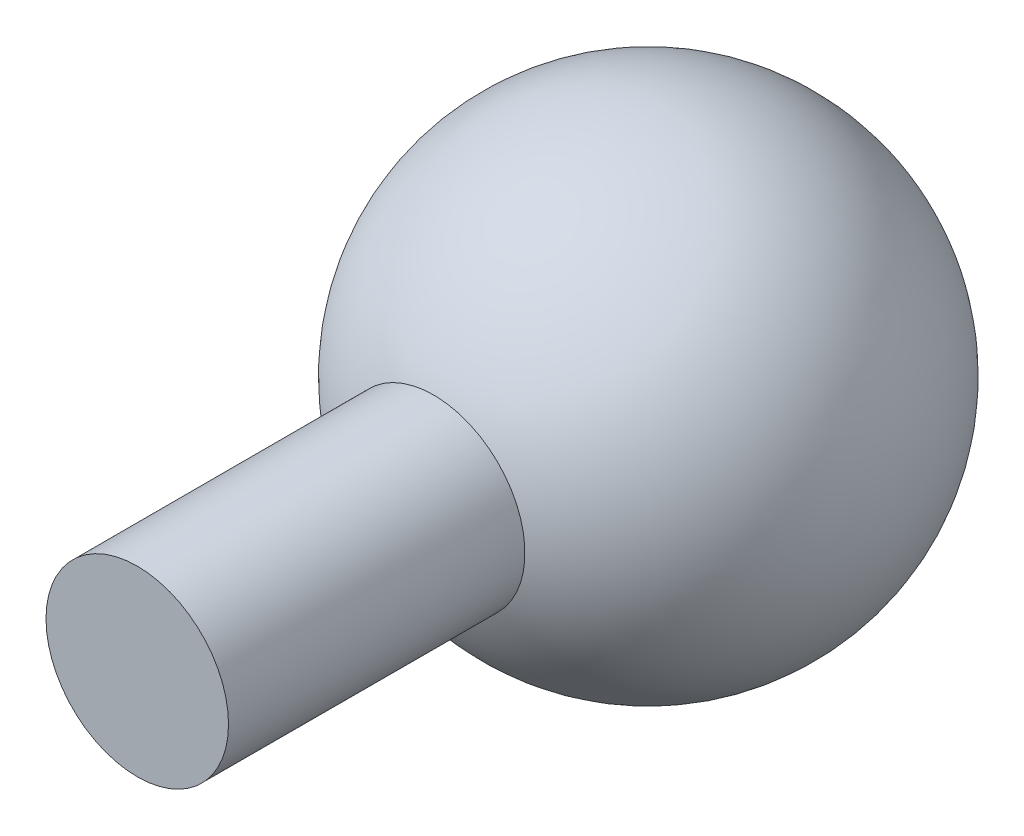
from build123d import *

# Parameters (mm, degrees)
ESQUISSE2_R        = 2.5
BOSS_EXTRU_1_DEPTH = 14


with BuildPart() as part:
    # Esquisse1 → Révolution3 (revolve)
    with BuildSketch(Plane.XY):
        with BuildLine():
            Line((0, 6.389898843), (0, -6.389898843))
            ThreePointArc((0, -6.389898843), (-6.389898843, 0), (0, 6.389898843))
        make_face()
    revolve(axis=Axis((0, 0, 0), (0, 1, 0)))

    # Esquisse2 → Boss.-Extru.1 (add)
    with BuildSketch(Plane.XY):
        with Locations(Location((0, 0, 0), (0, 0, 180))):
            Circle(ESQUISSE2_R)
    extrude(amount=BOSS_EXTRU_1_DEPTH)


solid = part.part
